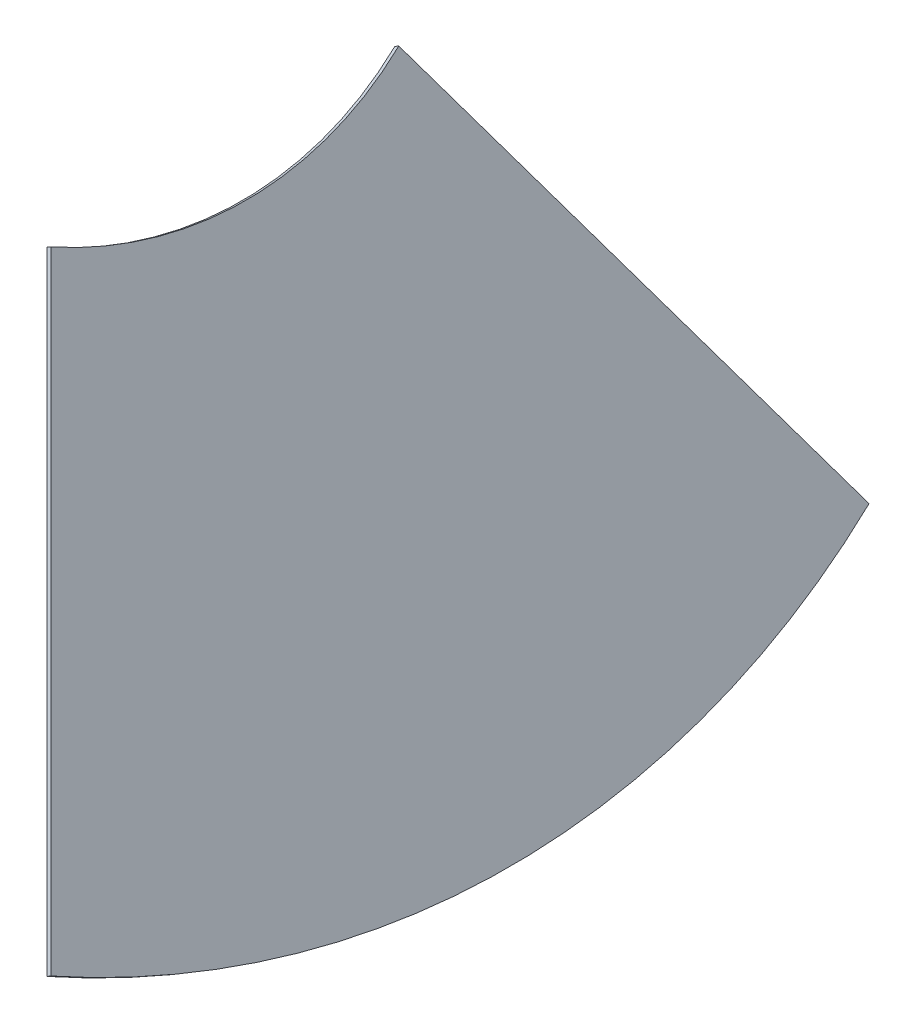
from build123d import *

# Parameters (mm, degrees)
THICKEN1_T1 = 1
THICKEN1_T2 = 1


with BuildPart() as body_1:
    # Sketch2 → Surface-Plane1: a flat surface bounded by the sketch
    with BuildSketch(Plane(origin=(18.304702573, 56.103893903, 84.504712269), x_dir=(-0.3617763934446254, 0.6097357967348626, 0.7052234392916206), z_dir=(-0.8600121206459034, -0.5102736053747404, -1.0969032612691395e-15)), mode=Mode.PRIVATE) as surface_plane1_1_region:
        with BuildLine():
            Line((-158.264155059, -288.964285994), (-88.353199476, -75.303587479))
            ThreePointArc((-88.353199476, -75.303587479), (-154.539912555, -34.528871866), (-194.96195103, 31.873818041))
            Line((-194.96195103, 31.873818041), (-408.99153859, -36.899515812))
            ThreePointArc((-408.99153859, -36.899515812), (-313.925122407, -193.068427437), (-158.264155059, -288.964285994))
        make_face()
    surface_plane1_1 = surface_plane1_1_region.sketch.faces()[0]
    add(Solid.thicken(surface_plane1_1, THICKEN1_T1))
    add(Solid.thicken(surface_plane1_1, -THICKEN1_T2))


solid = body_1.part
